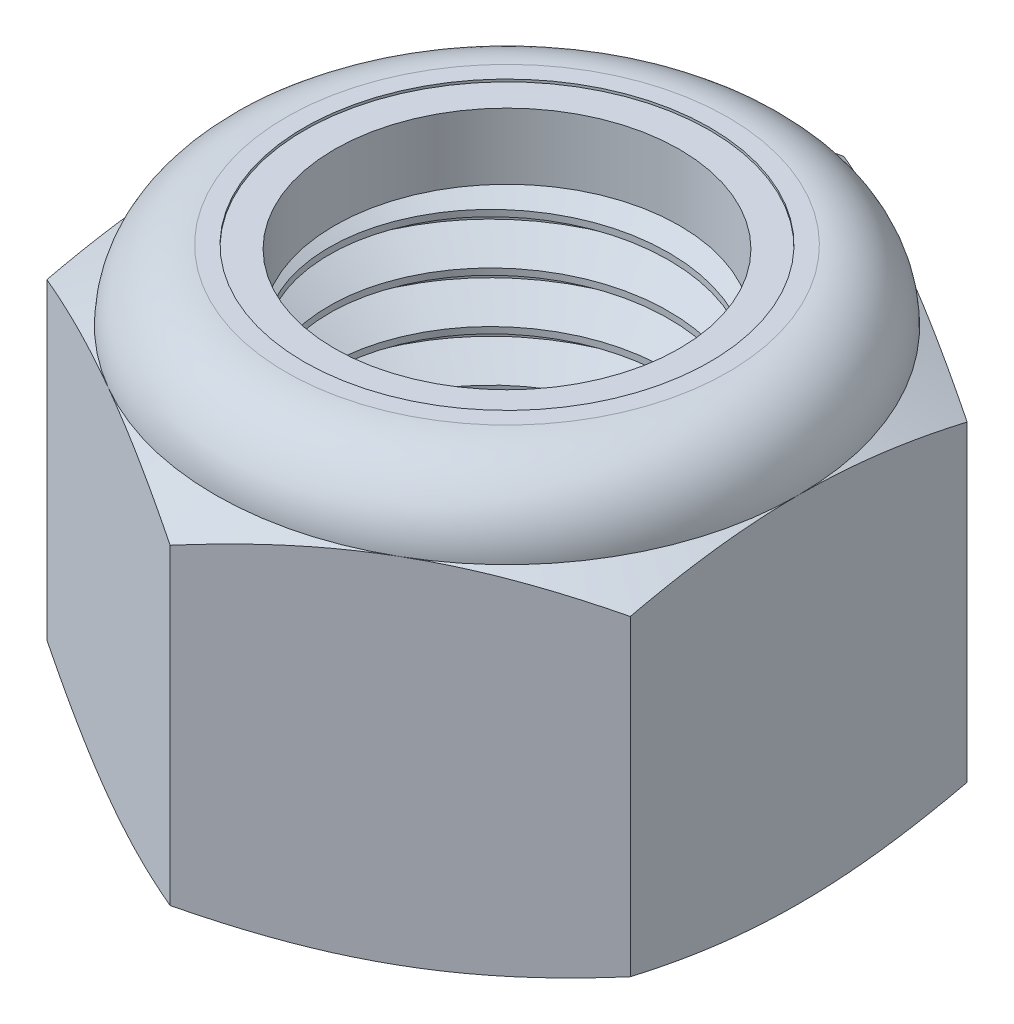
from build123d import *

# Parameters (mm, degrees)
SKETCH1_R         = 12.7
EXTRUDE1_DEPTH    = 26.590625
SKETCH2_W         = 12.7
SKETCH2_H         = 22.158854167
CUT_SWEEP1_PITCH  = 3.175
CUT_SWEEP1_HEIGHT = 29.765625
CUT_SWEEP1_RADIUS = 12.7
SKETCH12_W        = 13.97
SKETCH12_H        = 22.158854167


with BuildPart() as part:
    # Sketch1 → Extrude1 (new body)
    with BuildSketch(Plane(origin=(0, 0, 0), x_dir=(1, 0, 0), z_dir=(0, 1, 0))):
        Polygon((0, 21.080501704), (-18.25625, 10.540250852), (-18.25625, -10.540250852), (0, -21.080501704), (18.25625, -10.540250852), (18.25625, 10.540250852), align=None)
        with Locations(Location((0, 0, 0), (0, 0, 270))):
            Circle(SKETCH1_R, mode=Mode.SUBTRACT)
    extrude(amount=EXTRUDE1_DEPTH)

    # Sketch5 → Cut-Revolve3 (revolve, cut)
    with BuildSketch(Plane(origin=(0, 0, 0), x_dir=(0, 0, -1), z_dir=(1, 0, 0))):
        with BuildLine():
            Line((0, 0), (18.25625, 0))
            Line((18.25625, 0), (21.080501704, 1.316970198))
            Line((21.080501704, 1.316970198), (21.080501704, 20.841883969))
            Line((21.080501704, 20.841883969), (18.25625, 22.158854167))
            ThreePointArc((18.25625, 22.158854167), (16.958214376, 25.292589376), (13.824479167, 26.590625))
            Line((13.824479167, 26.590625), (13.824479167, 27.860625))
            Line((13.824479167, 27.860625), (22.350501704, 27.860625))
            Line((22.350501704, 27.860625), (22.350501704, -1.27))
            Line((22.350501704, -1.27), (0, -1.27))
            Line((0, -1.27), (0, 0))
        make_face()
    revolve(axis=Axis((0, 0, 0), (0, 1, 0)), mode=Mode.SUBTRACT)

    # Sketch6 → Cut-Revolve4 (revolve, cut)
    with BuildSketch(Plane(origin=(0, 0, 0), x_dir=(0, 0, -1), z_dir=(1, 0, 0)), mode=Mode.PRIVATE) as cut_revolve4_sk:
        with BuildLine():
            Line((0, 22.158854167), (18.10385, 22.158854167))
            ThreePointArc((18.10385, 22.158854167), (16.850451302, 25.184826302), (13.824479167, 26.438225))
            Line((13.824479167, 26.438225), (6.912239583, 26.438225))
            Line((6.912239583, 26.438225), (6.912239583, 27.860625))
            Line((6.912239583, 27.860625), (0, 27.860625))
            Line((0, 27.860625), (0, 22.158854167))
        make_face()
    revolve(cut_revolve4_sk.sketch.rotate(Axis((0, 27.860625, 0), (0, -1, 0)), 180), axis=Axis((0, 27.860625, 0), (0, -1, 0)), mode=Mode.SUBTRACT)

    # Sketch4 → Cut-Revolve2 (revolve, cut)
    with BuildSketch(Plane(origin=(0, 0, 0), x_dir=(0, 0, -1), z_dir=(1, 0, 0))):
        Polygon((0, 22.158854167), (13.97, 22.158854167), (0, 15.644536182), align=None)
        Polygon((0, 6.514317984), (13.97, 0), (0, 0), align=None)
    revolve(axis=Axis((0, 0, 0), (0, 1, 0)), mode=Mode.SUBTRACT)

    # Sketch12 → Revolve4 (revolve)
    with BuildSketch(Plane(origin=(0, 0, 0), x_dir=(0, 0, -1), z_dir=(1, 0, 0))):
        with Locations((6.985, 11.079427084)):
            Rectangle(SKETCH12_W, SKETCH12_H)
    revolve(axis=Axis((0, 0, 0), (0, 1, 0)))


with BuildPart() as body_2:
    # Sketch7 → Revolve2 (revolve)
    with BuildSketch(Plane(origin=(0, 0, 0), x_dir=(0, 0, -1), z_dir=(1, 0, 0))):
        with BuildLine():
            Line((10.795, 22.235054167), (18.026959222, 22.235054167))
            ThreePointArc((18.026959222, 22.235054167), (16.769505774, 25.157764525), (13.824479167, 26.362025))
            Line((13.824479167, 26.362025), (10.795, 26.362025))
            Line((10.795, 26.362025), (10.795, 22.235054167))
        make_face()
    revolve(axis=Axis((0, 22.235054167, 0), (0, 1, 0)))


with BuildPart() as body_3:
    # Sketch2 → Revolve1 (revolve)
    with BuildSketch(Plane(origin=(0, 0, 0), x_dir=(0, 0, -1), z_dir=(1, 0, 0))):
        with Locations((6.35, 11.079427084)):
            Rectangle(SKETCH2_W, SKETCH2_H)
    revolve(axis=Axis((0, -12.7, 0), (0, 1, 0)))

    # Cut-Sweep1: sweep along a helix
    with BuildLine() as cut_sweep1_path:
        Helix(CUT_SWEEP1_PITCH, CUT_SWEEP1_HEIGHT, CUT_SWEEP1_RADIUS, center=(0, 22.158854167, 0), direction=(0, -1, 0))
    # Sketch9 → Cut-Sweep1 (sweep, cut)
    with BuildSketch(Plane(origin=(0, 0, 0), x_dir=(0, 0, -1), z_dir=(1, 0, 0))):
        Polygon((13.043703832, 21.960416667), (12.871851916, 25.036197917), (10.637777007, 23.746354167), (10.637777007, 23.349479167), align=None)
    sweep(path=cut_sweep1_path.line, is_frenet=True, mode=Mode.SUBTRACT)

    # Sketch11 → Revolve3 (revolve)
    with BuildSketch(Plane(origin=(0, 0, 0), x_dir=(0, 0, -1), z_dir=(1, 0, 0))):
        Polygon((0, 0), (13.97, 0), (0, 6.514317984), align=None)
    revolve(axis=Axis((0, 26.590625, 0), (0, -1, 0)))


with BuildPart() as part_1:
    add(part.part)

    # Combine1: cut body 3
    add(body_3.part, mode=Mode.SUBTRACT)


solid = Compound([body_2.part, part_1.part])
